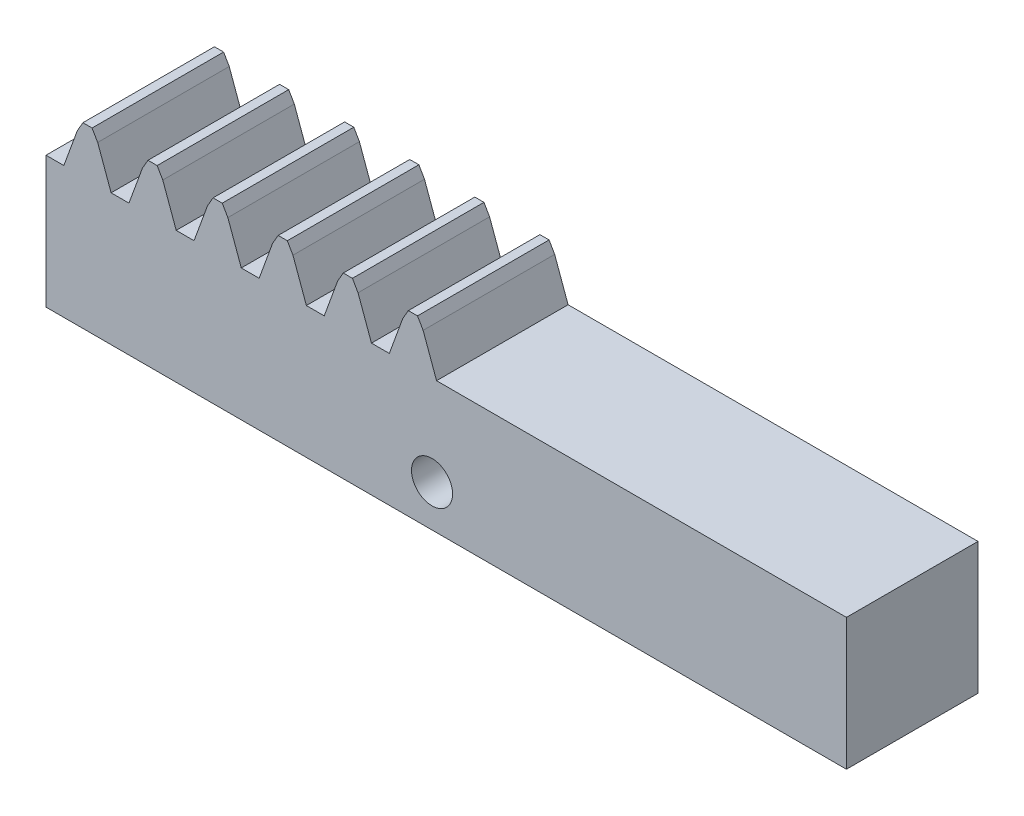
from build123d import *
from OCP.BRepFilletAPI import BRepFilletAPI_MakeChamfer

# Parameters (mm, degrees)
BOSS_EXTRUDE1_DEPTH      = 6.35
BOSS_EXTRUDE1_DEPTH_BACK = 6.35
SKETCH2_R                = 1.984375
CUT_EXTRUDE1_DEPTH       = 35
CHAMFER1_SIZE            = 0.2
CHAMFER1_SIZE2           = 0.99759701
SKETCH3_W                = 12.7
SKETCH3_H                = 12.7
BOSS_EXTRUDE2_DEPTH      = 27
SKETCH4_R                = 1.984375
CUT_EXTRUDE2_DEPTH       = 55.743127936


with BuildPart() as part:
    # Sketch1 → Boss-Extrude1 (new, two sides: drawn at the far end of the back side and taken through both)
    with BuildSketch(Plane.XY.offset(-BOSS_EXTRUDE1_DEPTH_BACK)):
        Polygon((-23.4085, 6.35), (-21.7705, 10.85), (-20.4865, 10.85), (-18.8485, 6.35), (-17.1255, 6.35), (-15.4875, 10.85), (-14.2035, 10.85), (-12.5655, 6.35), (-10.8425, 6.35), (-9.2045, 10.85), (-7.9205, 10.85), (-6.2825, 6.35), (-4.5595, 6.35), (-2.9215, 10.85), (-1.6375, 10.85), (0.0005, 6.35), (1.7235, 6.35), (3.3615, 10.85), (4.6455, 10.85), (6.2835, 6.35), (8.0065, 6.35), (9.6445, 10.85), (10.9285, 10.85), (12.5665, 6.35), (14.2895, 6.35), (18.8495, 6.35), (20.5725, 6.35), (25.1325, 6.35), (25.1325, -6.35), (-25.1325, -6.35), (-25.1325, 6.35), align=None)
    extrude(amount=BOSS_EXTRUDE1_DEPTH + BOSS_EXTRUDE1_DEPTH_BACK)

    # Sketch2 → Cut-Extrude1 (cut)
    with BuildSketch(Plane.ZY.offset(25.1325)):
        with Locations((0, 2.35)):
            Circle(SKETCH2_R)
    extrude(amount=-CUT_EXTRUDE1_DEPTH, mode=Mode.SUBTRACT)

    # Chamfer1: one chamfer whose edges measure the first distance from different faces: ONE call of the kernel's chamfer builder (chamfer() names one face for all edges)
    chamfer1_edges_1 = [part.edges().sort_by_distance(p)[0] for p in [
        (-21.7705, 10.85, 0),
        (-20.4865, 10.85, 0),
    ]]
    chamfer1_side_1 = [part.faces().sort_by_distance(p)[0] for p in [
        (-21.1285, 10.85, 0),
    ]]
    chamfer1_edges_2 = [part.edges().sort_by_distance(p)[0] for p in [
        (-15.4875, 10.85, 0),
        (-14.2035, 10.85, 0),
    ]]
    chamfer1_side_2 = [part.faces().sort_by_distance(p)[0] for p in [
        (-14.8455, 10.85, 0),
    ]]
    chamfer1_edges_3 = [part.edges().sort_by_distance(p)[0] for p in [
        (-9.2045, 10.85, 0),
        (-7.9205, 10.85, 0),
    ]]
    chamfer1_side_3 = [part.faces().sort_by_distance(p)[0] for p in [
        (-8.5625, 10.85, 0),
    ]]
    chamfer1_edges_4 = [part.edges().sort_by_distance(p)[0] for p in [
        (-2.9215, 10.85, 0),
        (-1.6375, 10.85, 0),
    ]]
    chamfer1_side_4 = [part.faces().sort_by_distance(p)[0] for p in [
        (-2.2795, 10.85, 0),
    ]]
    chamfer1_edges_5 = [part.edges().sort_by_distance(p)[0] for p in [
        (3.3615, 10.85, 0),
        (4.6455, 10.85, 0),
    ]]
    chamfer1_side_5 = [part.faces().sort_by_distance(p)[0] for p in [
        (4.0035, 10.85, 0),
    ]]
    chamfer1_edges_6 = [part.edges().sort_by_distance(p)[0] for p in [
        (9.6445, 10.85, 0),
        (10.9285, 10.85, 0),
    ]]
    chamfer1_side_6 = [part.faces().sort_by_distance(p)[0] for p in [
        (10.2865, 10.85, 0),
    ]]
    chamfer1 = BRepFilletAPI_MakeChamfer(part.part.solid().wrapped)
    for e in chamfer1_edges_1:
        chamfer1.Add(CHAMFER1_SIZE, CHAMFER1_SIZE2, e.wrapped, chamfer1_side_1[0].wrapped)  # the first distance lies on this face
    for e in chamfer1_edges_2:
        chamfer1.Add(CHAMFER1_SIZE, CHAMFER1_SIZE2, e.wrapped, chamfer1_side_2[0].wrapped)  # the first distance lies on this face
    for e in chamfer1_edges_3:
        chamfer1.Add(CHAMFER1_SIZE, CHAMFER1_SIZE2, e.wrapped, chamfer1_side_3[0].wrapped)  # the first distance lies on this face
    for e in chamfer1_edges_4:
        chamfer1.Add(CHAMFER1_SIZE, CHAMFER1_SIZE2, e.wrapped, chamfer1_side_4[0].wrapped)  # the first distance lies on this face
    for e in chamfer1_edges_5:
        chamfer1.Add(CHAMFER1_SIZE, CHAMFER1_SIZE2, e.wrapped, chamfer1_side_5[0].wrapped)  # the first distance lies on this face
    for e in chamfer1_edges_6:
        chamfer1.Add(CHAMFER1_SIZE, CHAMFER1_SIZE2, e.wrapped, chamfer1_side_6[0].wrapped)  # the first distance lies on this face
    add(Compound.cast(chamfer1.Shape()), mode=Mode.REPLACE)

    # Sketch3 → Boss-Extrude2 (add)
    with BuildSketch(Plane(origin=(25.1325, 0, 0), x_dir=(0, 0, -1), z_dir=(1, 0, 0))):
        Rectangle(SKETCH3_W, SKETCH3_H)
    extrude(amount=BOSS_EXTRUDE2_DEPTH)

    # Sketch4 → Cut-Extrude2 (cut, through all)
    with BuildSketch(Plane.XY.offset(6.35)):
        with Locations((12.1325, -2.35)):
            Circle(SKETCH4_R)
    extrude(amount=-CUT_EXTRUDE2_DEPTH, mode=Mode.SUBTRACT)


solid = part.part
